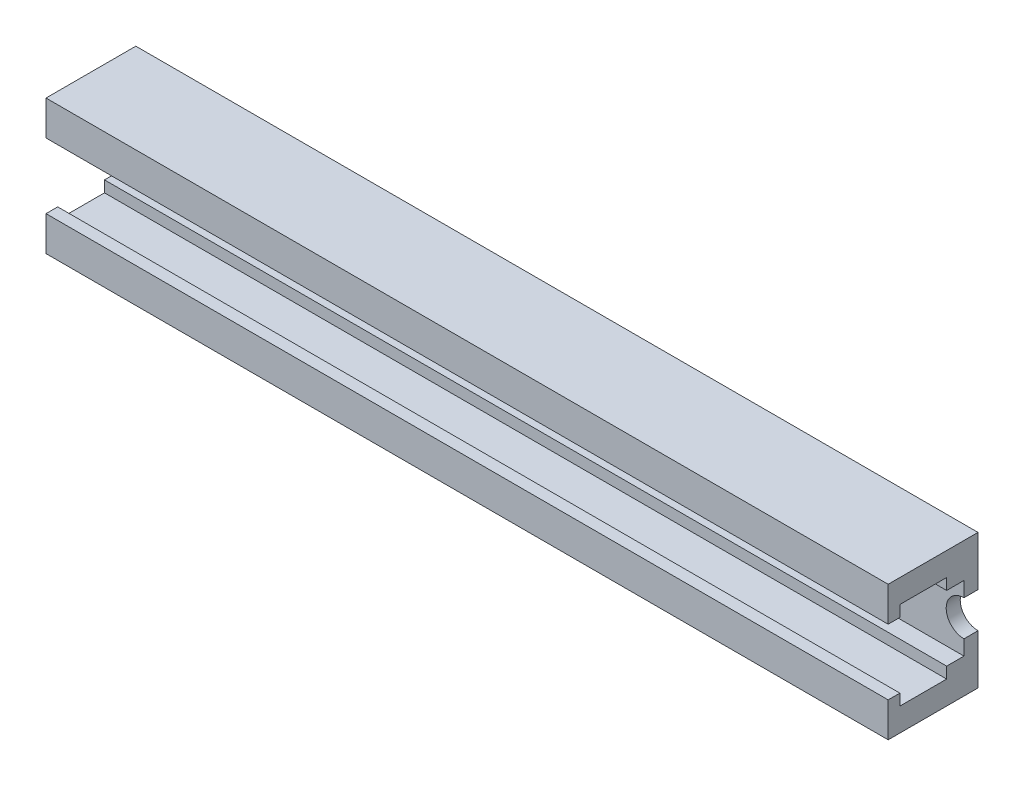
from build123d import *

# Parameters (mm, degrees)
BOSS_EXTRUDE1_DEPTH = 228.6
SKETCH3_R           = 2.413
CUT_EXTRUDE1_DEPTH  = 1.905
LPATTERN1_COUNT     = 3
LPATTERN1_PITCH     = 76.2
SKETCH4_W           = 22.804701919
SKETCH4_H           = 24.737303777
CUT_EXTRUDE2_DEPTH  = 342.9


with BuildPart() as part:
    # Sketch2 → Boss-Extrude1 (new, symmetric)
    with BuildSketch(Plane(origin=(0, 0, 0), x_dir=(0, 0, -1), z_dir=(1, 0, 0))):
        Polygon((0, 9.144), (-12.192, 9.144), (-12.192, 4.445), (-10.6045, 4.445), (-10.6045, 5.969), (-4.2545, 5.969), (-4.2545, 4.445), (-1.905, 4.445), (-1.905, -4.445), (-4.2545, -4.445), (-4.2545, -5.969), (-10.6045, -5.969), (-10.6045, -4.445), (-12.192, -4.445), (-12.192, -9.144), (0, -9.144), align=None)
    extrude(amount=BOSS_EXTRUDE1_DEPTH, both=True)

    # Sketch3 → Cut-Extrude1 (cut)
    with BuildSketch(Plane.XY.offset(1.905)):
        with Locations((38.1, 0)):
            Circle(SKETCH3_R)
    cut_extrude1 = extrude(amount=-CUT_EXTRUDE1_DEPTH, mode=Mode.SUBTRACT)

    # LPattern1: Cut-Extrude1 ×3
    with Locations(*[(i * LPATTERN1_PITCH, 0, 0) for i in range(1, LPATTERN1_COUNT)]):
        add(cut_extrude1, mode=Mode.SUBTRACT)

    # SurfaceCut1
    split(bisect_by=Plane(origin=(0, 0, 0), x_dir=(0, 0, -1), z_dir=(1, 0, 0)), keep=Keep.TOP)

    # Mirror1: part across plane


with BuildPart() as part_1:
    add(part.part)
    add(part.part.mirror(Plane(origin=(0, 0, 0), x_dir=(0, 0, 1), z_dir=(1, 0, 0))))

    # Sketch4 → Cut-Extrude2 (cut)
    with BuildSketch(Plane(origin=(228.6, 0, 0), x_dir=(0, 0, -1), z_dir=(1, 0, 0))):
        with Locations((-5.709479629, -0.367194353)):
            Rectangle(SKETCH4_W, SKETCH4_H)
    extrude(amount=-CUT_EXTRUDE2_DEPTH, mode=Mode.SUBTRACT)


solid = part_1.part
